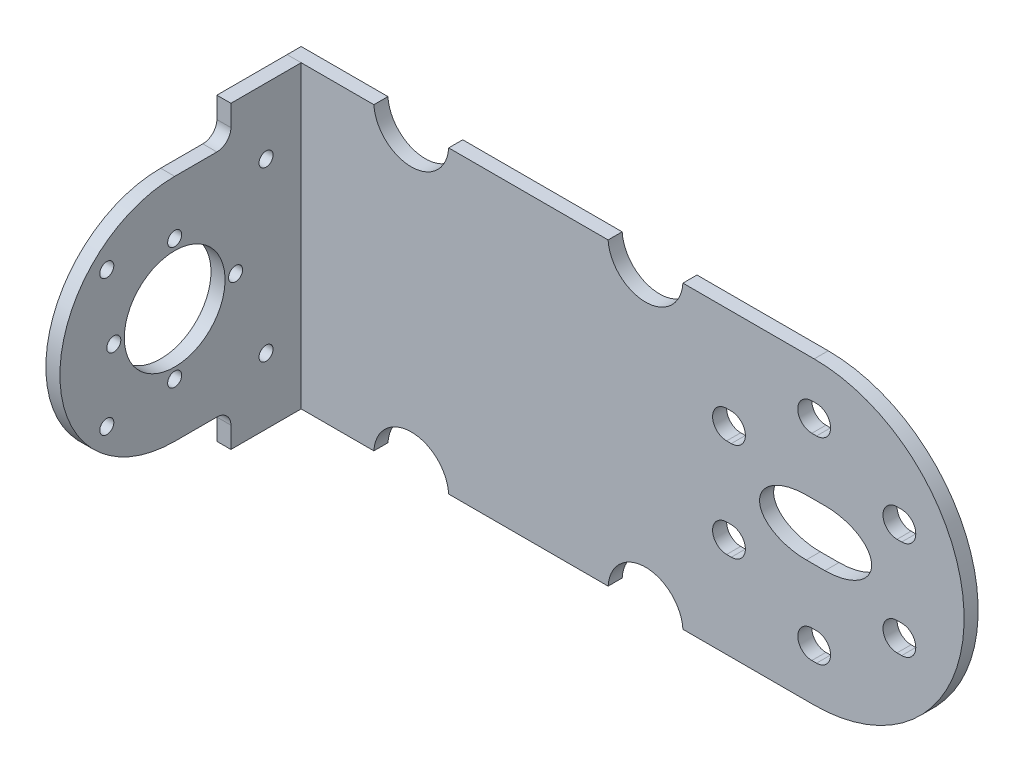
from build123d import *

# Parameters (mm, degrees)
BOSS_EXTRUDE1_DEPTH = 3
SKETCH2_R           = 1.5
BOSS_EXTRUDE2_DEPTH = 3
SKETCH3_R           = 6
CUT_EXTRUDE1_DEPTH  = 150.495916109
CUT_EXTRUDE2_DEPTH  = 128.79866979
CUT_EXTRUDE4_DEPTH  = 3


with BuildPart() as part:
    # Sketch1 → Boss-Extrude1 (new body)
    with BuildSketch(Plane.XY):
        with BuildLine():
            Line((-112.5, 32), (0, 32))
            ThreePointArc((0, 32), (32, 0), (0, -32))
            Line((0, -32), (-112.5, -32))
            Line((-112.5, -32), (-112.5, 32))
        make_face()
        with BuildLine():
            Line((17.686533479, 13.5), (18.686533479, 13.5))
            ThreePointArc((18.686533479, 13.5), (21.686533479, 10.5), (18.686533479, 7.5))
            Line((18.686533479, 7.5), (17.686533479, 7.5))
            ThreePointArc((17.686533479, 7.5), (14.686533479, 10.5), (17.686533479, 13.5))
        make_face(mode=Mode.SUBTRACT)
        with BuildLine():
            Line((17.686533479, -7.5), (18.686533479, -7.5))
            ThreePointArc((18.686533479, -7.5), (21.686533479, -10.5), (18.686533479, -13.5))
            Line((18.686533479, -13.5), (17.686533479, -13.5))
            ThreePointArc((17.686533479, -13.5), (14.686533479, -10.5), (17.686533479, -7.5))
        make_face(mode=Mode.SUBTRACT)
        with BuildLine():
            Line((-0.5, -18), (0.5, -18))
            ThreePointArc((0.5, -18), (3.5, -21), (0.5, -24))
            Line((0.5, -24), (-0.5, -24))
            ThreePointArc((-0.5, -24), (-3.5, -21), (-0.5, -18))
        make_face(mode=Mode.SUBTRACT)
        with BuildLine():
            Line((-18.686533479, -7.5), (-17.686533479, -7.5))
            ThreePointArc((-17.686533479, -7.5), (-14.686533479, -10.5), (-17.686533479, -13.5))
            Line((-17.686533479, -13.5), (-18.686533479, -13.5))
            ThreePointArc((-18.686533479, -13.5), (-21.686533479, -10.5), (-18.686533479, -7.5))
        make_face(mode=Mode.SUBTRACT)
        with BuildLine():
            Line((-17.686533479, 7.5), (-18.686533479, 7.5))
            ThreePointArc((-18.686533479, 7.5), (-21.686533479, 10.5), (-18.686533479, 13.5))
            Line((-18.686533479, 13.5), (-17.686533479, 13.5))
            ThreePointArc((-17.686533479, 13.5), (-14.686533479, 10.5), (-17.686533479, 7.5))
        make_face(mode=Mode.SUBTRACT)
        with BuildLine():
            Line((0.5, 18), (-0.5, 18))
            ThreePointArc((-0.5, 18), (-3.5, 21), (-0.5, 24))
            Line((-0.5, 24), (0.5, 24))
            ThreePointArc((0.5, 24), (3.5, 21), (0.5, 18))
        make_face(mode=Mode.SUBTRACT)
    extrude(amount=BOSS_EXTRUDE1_DEPTH)

    # Sketch3 → Cut-Extrude1 (cut, through all)
    with BuildSketch(Plane(origin=(-68.399252687, 0, -51.542533886), x_dir=(0, 1, 0), z_dir=(0.798635510047294, 0, 0.6018150231520466))):
        with Locations(Location((0, 1.0136449, 0), (0, 0, 90))):
            Circle(SKETCH3_R)
    extrude(amount=CUT_EXTRUDE1_DEPTH, mode=Mode.SUBTRACT)

    # Sketch4 → Cut-Extrude2 (cut, through all)
    with BuildSketch(Plane.XY.offset(3)):
        with BuildLine():
            Line((2.296821411, -6), (-1.684313054, -6))
            add(Edge.make_bspline(
                [(-1.684313054, 6), (-11.654153901, 6), (-11.654153901, 0), (-11.654153901, -6), (-1.684313054, -6)],
                knots=[4.71238898, 4.71238898, 4.71238898, 6.283185307, 6.283185307, 7.853981634, 7.853981634, 7.853981634], degree=2, weights=[1, 0.707106781, 1, 0.707106781, 1]))
            Line((-1.684313054, 6), (2.296821411, 6))
            add(Edge.make_bspline(
                [(2.296821411, -6), (12.266662258, -6), (12.266662258, 0), (12.266662258, 6), (2.296821411, 6)],
                knots=[4.71238898, 4.71238898, 4.71238898, 6.283185307, 6.283185307, 7.853981634, 7.853981634, 7.853981634], degree=2, weights=[1, 0.707106781, 1, 0.707106781, 1]))
        make_face()
    extrude(amount=-CUT_EXTRUDE2_DEPTH, mode=Mode.SUBTRACT)

    # Sketch5 → Cut-Extrude4 (cut)
    with BuildSketch(Plane.XY.offset(3)):
        with BuildLine():
            ThreePointArc((-86, 40.5), (-80.522774425, 38.330951895), (-78.015640289, 33))
            Line((-78.015640289, 33), (-43.984359711, 33))
            ThreePointArc((-43.984359711, 33), (-41.477225575, 38.330951895), (-36, 40.5))
            Line((-36, 40.5), (-86, 40.5))
        make_face()
        with BuildLine():
            ThreePointArc((-78, 32.5), (-78.003911028, 32.750122279), (-78.015640289, 33))
            ThreePointArc((-78.015640289, 33), (-80.522774425, 38.330951895), (-86, 40.5))
            ThreePointArc((-86, 40.5), (-91.830951895, 37.977225575), (-93.984359711, 32))
            Line((-93.984359711, 32), (-78.015640289, 32))
            ThreePointArc((-78.015640289, 32), (-78.003911028, 32.249877721), (-78, 32.5))
        make_face()
        with BuildLine():
            ThreePointArc((-93.984359711, 32), (-86, 24.5), (-78.015640289, 32))
            Line((-78.015640289, 32), (-93.984359711, 32))
        make_face()
        with BuildLine():
            ThreePointArc((-36, 40.5), (-41.477225575, 38.330951895), (-43.984359711, 33))
            ThreePointArc((-43.984359711, 33), (-44, 32.5), (-43.984359711, 32))
            Line((-43.984359711, 32), (-28.015640289, 32))
            ThreePointArc((-28.015640289, 32), (-28.003911028, 32.249877721), (-28, 32.5))
            ThreePointArc((-28, 32.5), (-30.343145751, 38.156854249), (-36, 40.5))
        make_face()
        with BuildLine():
            Line((-28.015640289, 32), (-43.984359711, 32))
            ThreePointArc((-43.984359711, 32), (-36, 24.5), (-28.015640289, 32))
        make_face()
        with BuildLine():
            ThreePointArc((-86, -40.5), (-80.522774425, -38.330951895), (-78.015640289, -33))
            ThreePointArc((-78.015640289, -33), (-78.003911028, -32.750122279), (-78, -32.5))
            ThreePointArc((-78, -32.5), (-78.003911028, -32.249877721), (-78.015640289, -32))
            Line((-78.015640289, -32), (-93.984359711, -32))
            ThreePointArc((-93.984359711, -32), (-91.830951895, -37.977225575), (-86, -40.5))
        make_face()
        with BuildLine():
            ThreePointArc((-78.015640289, -32), (-86, -24.5), (-93.984359711, -32))
            Line((-93.984359711, -32), (-78.015640289, -32))
        make_face()
        with BuildLine():
            Line((-43.984359711, -33), (-78.015640289, -33))
            ThreePointArc((-78.015640289, -33), (-80.522774425, -38.330951895), (-86, -40.5))
            Line((-86, -40.5), (-36, -40.5))
            ThreePointArc((-36, -40.5), (-41.477225575, -38.330951895), (-43.984359711, -33))
        make_face()
        with BuildLine():
            ThreePointArc((-43.984359711, -32), (-44, -32.5), (-43.984359711, -33))
            ThreePointArc((-43.984359711, -33), (-41.477225575, -38.330951895), (-36, -40.5))
            ThreePointArc((-36, -40.5), (-30.343145751, -38.156854249), (-28, -32.5))
            ThreePointArc((-28, -32.5), (-28.003911028, -32.249877721), (-28.015640289, -32))
            Line((-28.015640289, -32), (-43.984359711, -32))
        make_face()
        with BuildLine():
            ThreePointArc((-28.015640289, -32), (-36, -24.5), (-43.984359711, -32))
            Line((-43.984359711, -32), (-28.015640289, -32))
        make_face()
    extrude(amount=-CUT_EXTRUDE4_DEPTH, mode=Mode.SUBTRACT)


with BuildPart() as body_2:
    # Sketch2 → Boss-Extrude2 (new body)
    # profile 1 of 2: a face of its own
    with BuildSketch(Plane.ZY.offset(112.5)):
        with BuildLine():
            Line((3, 0), (3, -32))
            Line((3, -32), (18, -32))
            Line((18, -32), (18, -27.5))
            ThreePointArc((18, -27.5), (18.878679656, -25.378679656), (21, -24.5))
            Line((21, -24.5), (30, -24.5))
            ThreePointArc((30, -24.5), (54.5, 0), (30, 24.5))
            Line((30, 24.5), (21, 24.5))
            ThreePointArc((21, 24.5), (18.878679656, 25.378679656), (18, 27.5))
            Line((18, 27.5), (18, 32))
            Line((18, 32), (3, 32))
            Line((3, 32), (3, 0))
        make_face()
        with Locations((10.5, -17.944358445)):
            Circle(SKETCH2_R, mode=Mode.SUBTRACT)
        with BuildLine():
            ThreePointArc((18.5, 0), (17, -1.5), (15.5, 0))
            ThreePointArc((15.5, 0), (17, 1.5), (18.5, 0))
        make_face(mode=Mode.SUBTRACT)
        with Locations((30, -13)):
            Circle(SKETCH2_R, mode=Mode.SUBTRACT)
        with Locations((44.495689014, -14.495689014)):
            Circle(SKETCH2_R, mode=Mode.SUBTRACT)
        with Locations((10.5, 17.944358445)):
            Circle(SKETCH2_R, mode=Mode.SUBTRACT)
        with BuildLine():
            ThreePointArc((40.75, 0), (30, -10.75), (19.25, 0))
            ThreePointArc((19.25, 0), (30, 10.75), (40.75, 0))
        make_face(mode=Mode.SUBTRACT)
        with Locations((30, 13)):
            Circle(SKETCH2_R, mode=Mode.SUBTRACT)
        with BuildLine():
            ThreePointArc((44.5, 0), (43, -1.5), (41.5, 0))
            ThreePointArc((41.5, 0), (43, 1.5), (44.5, 0))
        make_face(mode=Mode.SUBTRACT)
        with Locations((44.495689014, 14.495689014)):
            Circle(SKETCH2_R, mode=Mode.SUBTRACT)
    # profile 2 of 2: a face of its own
    with BuildSketch(Plane.ZY.offset(112.5)):
        with BuildLine():
            Line((3, 0), (3, -32))
            Line((3, -32), (18, -32))
            Line((18, -32), (18, -27.5))
            ThreePointArc((18, -27.5), (18.878679656, -25.378679656), (21, -24.5))
            Line((21, -24.5), (30, -24.5))
            ThreePointArc((30, -24.5), (54.5, 0), (30, 24.5))
            Line((30, 24.5), (21, 24.5))
            ThreePointArc((21, 24.5), (18.878679656, 25.378679656), (18, 27.5))
            Line((18, 27.5), (18, 32))
            Line((18, 32), (3, 32))
            Line((3, 32), (3, 0))
        make_face()
        with Locations((10.5, -17.944358445)):
            Circle(SKETCH2_R, mode=Mode.SUBTRACT)
        with BuildLine():
            ThreePointArc((18.5, 0), (17, -1.5), (15.5, 0))
            ThreePointArc((15.5, 0), (17, 1.5), (18.5, 0))
        make_face(mode=Mode.SUBTRACT)
        with Locations((30, -13)):
            Circle(SKETCH2_R, mode=Mode.SUBTRACT)
        with Locations((44.495689014, -14.495689014)):
            Circle(SKETCH2_R, mode=Mode.SUBTRACT)
        with Locations((10.5, 17.944358445)):
            Circle(SKETCH2_R, mode=Mode.SUBTRACT)
        with BuildLine():
            ThreePointArc((40.75, 0), (30, -10.75), (19.25, 0))
            ThreePointArc((19.25, 0), (30, 10.75), (40.75, 0))
        make_face(mode=Mode.SUBTRACT)
        with Locations((30, 13)):
            Circle(SKETCH2_R, mode=Mode.SUBTRACT)
        with BuildLine():
            ThreePointArc((44.5, 0), (43, -1.5), (41.5, 0))
            ThreePointArc((41.5, 0), (43, 1.5), (44.5, 0))
        make_face(mode=Mode.SUBTRACT)
        with Locations((44.495689014, 14.495689014)):
            Circle(SKETCH2_R, mode=Mode.SUBTRACT)
    extrude(amount=-BOSS_EXTRUDE2_DEPTH)


solid = Compound([part.part, body_2.part])
